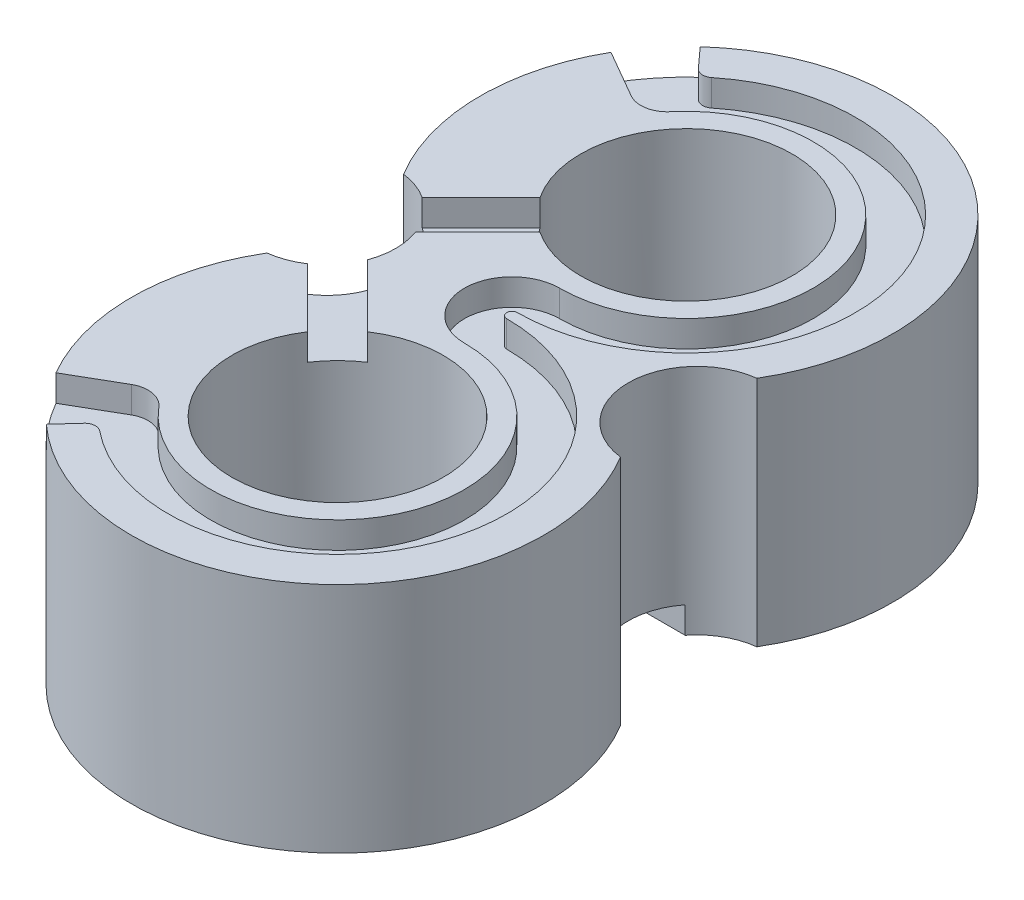
from build123d import *
from build123d.topology import SkipClean

# Parameters (mm, degrees)
SKETCH_1_R               = 19.5
EXTRUDE_1_DEPTH          = 22
CUT_EXTRUDE_1_DEPTH      = 61.170590823
CUT_EXTRUDE_1_DEPTH_BACK = 61.170590823
SKETCH_2_R               = 10
CUT_EXTRUDE_START        = -2.5
CUT_EXTRUDE_2_DEPTH      = 2.5
EXTRUDE_START            = -22
EXTRUDE_2_DEPTH          = 22
CUT_EXTRUDE_4_DEPTH      = 61.170590823
CUT_EXTRUDE_4_DEPTH_BACK = 61.170590823
SKETCH_5_R               = 6.5
CUT_EXTRUDE_5_DEPTH      = 2.5
FILLET_1_R               = 1
CUT_EXTRUDE_6_DEPTH      = 2.5


with BuildPart() as part:
    # 草图1 → 凸台-拉伸1 (new body)
    with BuildSketch(Plane(origin=(0, 0, 0), x_dir=(1, 0, 0), z_dir=(0, 1, 0))):
        Circle(SKETCH_1_R)
        with Locations((0, -33)):
            Circle(SKETCH_1_R)
    extrude(amount=EXTRUDE_1_DEPTH)

    # 草图2 → 切除-拉伸1 (cut, two sides: drawn at the far end of the back side and taken through both)
    with BuildSketch(Plane(origin=(0, 22, 0), x_dir=(1, 0, 0), z_dir=(0, 1, 0)).offset(-CUT_EXTRUDE_1_DEPTH_BACK)):
        with Locations(Location((0, 0, 0), (0, 0, 270))):
            Circle(SKETCH_2_R)
        with Locations(Location((0, -33, 0), (0, 0, 270))):
            Circle(SKETCH_2_R)
    extrude(amount=CUT_EXTRUDE_1_DEPTH + CUT_EXTRUDE_1_DEPTH_BACK, mode=Mode.SUBTRACT)

    # 草图3 → 切除-拉伸2 (cut)
    with BuildSketch(Plane(origin=(0, 22, 0), x_dir=(1, 0, 0), z_dir=(0, 1, 0)).offset(CUT_EXTRUDE_START)):
        with BuildLine():
            Line((-16.887495374, 9.75), (-12.369316877, 7.141428429))
            ThreePointArc((-12.369316877, 7.141428429), (-10.683653707, 6.844745078), (-9.202193277, 7.701924362))
            ThreePointArc((-9.202193277, 7.701924362), (10.872513333, 5.078233337), (0, -12))
            ThreePointArc((0, -12), (-4.5, -16.5), (0, -21))
            ThreePointArc((0, -21), (10.872513333, -38.078233337), (-9.202193277, -40.701924362))
            ThreePointArc((-9.202193277, -40.701924362), (-10.683653707, -39.844745078), (-12.369316877, -40.141428429))
            Line((-12.369316877, -40.141428429), (-16.887495374, -42.75))
            ThreePointArc((-16.887495374, -42.75), (-15.186446596, -45.232000645), (-13.123802868, -47.422752799))
            Line((-13.123802868, -47.422752799), (-11.421452311, -45.551909301))
            ThreePointArc((-11.421452311, -45.551909301), (-10.758297788, -45.227853244), (-10.053481376, -45.446988078))
            ThreePointArc((-10.053481376, -45.446988078), (15.085619133, -38.331425267), (0, -17))
            ThreePointArc((0, -17), (-0.5, -16.5), (0, -16))
            ThreePointArc((0, -16), (15.085619133, 5.331425267), (-10.053481376, 12.446988078))
            ThreePointArc((-10.053481376, 12.446988078), (-10.758297788, 12.227853244), (-11.421452311, 12.551909301))
            Line((-11.421452311, 12.551909301), (-13.123802868, 14.422752799))
            ThreePointArc((-13.123802868, 14.422752799), (-15.186446596, 12.232000645), (-16.887495374, 9.75))
        make_face()
    extrude(amount=CUT_EXTRUDE_2_DEPTH, mode=Mode.SUBTRACT)

    # 草图4 → 凸台-拉伸2 (add)
    with BuildSketch(Plane(origin=(0, 22, 0), x_dir=(1, 0, 0), z_dir=(0, 1, 0)).offset(EXTRUDE_START)):
        with BuildLine():
            ThreePointArc((11.012786163, -16.907500476), (11, -16.5), (11.012786163, -16.092499524))
            ThreePointArc((11.012786163, -16.092499524), (10.704484781, -16.299202605), (10.392304845, -16.5))
            ThreePointArc((10.392304845, -16.5), (10.704484781, -16.700797395), (11.012786163, -16.907500476))
        make_face()
        with BuildLine():
            ThreePointArc((-11.012786163, -16.092499524), (-11.003197327, -16.296149488), (-11, -16.5))
            ThreePointArc((-11, -16.5), (-11.003197327, -16.703850512), (-11.012786163, -16.907500476))
            ThreePointArc((-11.012786163, -16.907500476), (-10.704484781, -16.700797395), (-10.392304845, -16.5))
            ThreePointArc((-10.392304845, -16.5), (-10.704484781, -16.299202605), (-11.012786163, -16.092499524))
        make_face()
    extrude(amount=EXTRUDE_2_DEPTH)

    # 草图5 → 切除-拉伸4 (cut, two sides: drawn at the far end of the back side and taken through both)
    with SkipClean():  # the faces are left unmerged after this step: merging them gives an invalid solid
        with BuildSketch(Plane(origin=(0, 22, 0), x_dir=(1, 0, 0), z_dir=(0, 1, 0)).offset(-CUT_EXTRUDE_4_DEPTH_BACK)):
            with Locations((17.5, -16.5)):
                Circle(SKETCH_5_R)
            with Locations((-17.5, -16.5)):
                Circle(SKETCH_5_R)
        extrude(amount=CUT_EXTRUDE_4_DEPTH + CUT_EXTRUDE_4_DEPTH_BACK, mode=Mode.SUBTRACT)

    # 草图6 → 切除-拉伸5 (cut)
    with SkipClean():  # the faces are left unmerged after this step: merging them gives an invalid solid
        with BuildSketch(Plane.XZ.offset(CUT_EXTRUDE_START)):
            with BuildLine():
                Line((-12.376524617, 12.5), (-2, 12.5))
                Line((-2, 12.5), (-2, 20.5))
                Line((-2, 20.5), (-12.376524617, 20.5))
                ThreePointArc((-12.376524617, 20.5), (-11, 16.5), (-12.376524617, 12.5))
            make_face()
            with BuildLine():
                Line((2, 20.5), (2, 12.5))
                Line((2, 12.5), (12.376524617, 12.5))
                ThreePointArc((12.376524617, 12.5), (11, 16.5), (12.376524617, 20.5))
                Line((12.376524617, 20.5), (2, 20.5))
            make_face()
        extrude(amount=CUT_EXTRUDE_5_DEPTH, mode=Mode.SUBTRACT)

    # 圆角1
    fillet_1_edges = [part.edges().sort_by_distance(p)[0] for p in [
        (-2, 1.25, 20.5),
        (-2, 1.25, 12.5),
        (2, 1.25, 20.5),
        (2, 1.25, 12.5),
    ]]
    fillet(fillet_1_edges, radius=FILLET_1_R)

    # 草图7 → 切除-拉伸6 (cut)
    with SkipClean():  # the faces are left unmerged after this step: merging them gives an invalid solid
        with BuildSketch(Plane(origin=(0, 22, 0), x_dir=(1, 0, 0), z_dir=(0, 1, 0))):
            Polygon((-94.212388388, -97.040815513), (-15.085786438, -17.914213562), (1.414213562, -1.414213562), (-1.414213562, 1.414213562), (-17.914213562, -15.085786438), (-19.328427125, -16.5), (-15.503778834, -20.324648291), (-1.414213562, -34.414213562), (1.414213562, -31.585786438), (-13.671572875, -16.5), (-92.798174826, 62.62660195), (-316.593223793, 64.608809708), (-318.007437355, -95.058607756), align=None)
        extrude(amount=-CUT_EXTRUDE_6_DEPTH, mode=Mode.SUBTRACT)


solid = part.part
